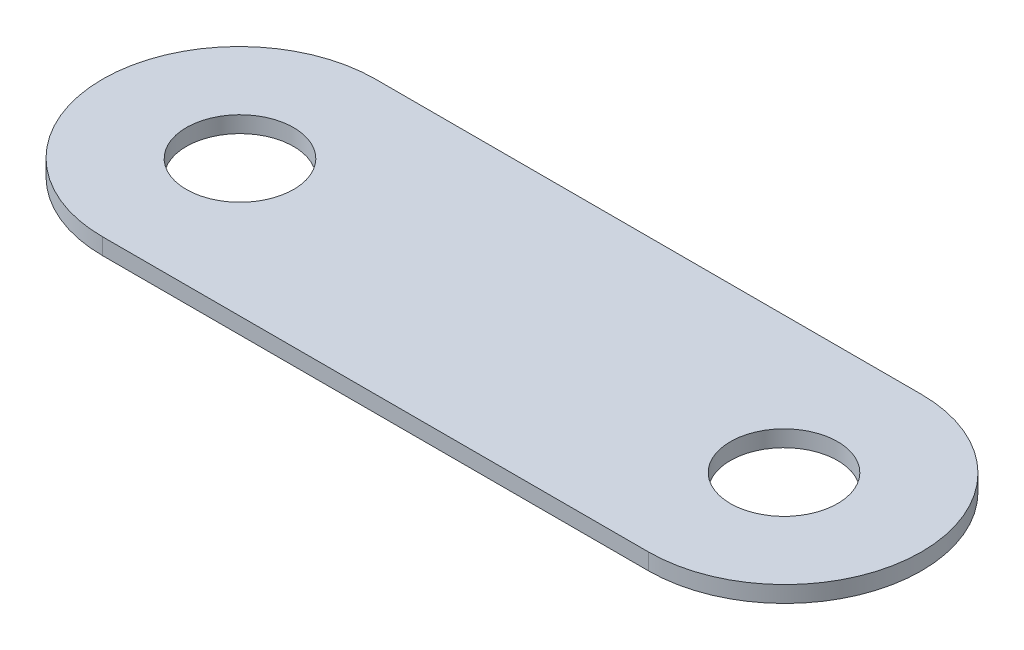
from build123d import *

# Parameters (mm, degrees)
BOSS_EXTRUDE1_DEPTH = 1.2
SKETCH2_R           = 3.93
CUT_EXTRUDE1_DEPTH  = 32.64553681


with BuildPart() as part:
    # Sketch1 → Boss-Extrude1 (new body)
    with BuildSketch(Plane(origin=(0, 0, 0), x_dir=(1, 0, 0), z_dir=(0, 1, 0))):
        with BuildLine():
            Line((-20, 10), (20, 10))
            ThreePointArc((20, 10), (30, 0), (20, -10))
            Line((20, -10), (-20, -10))
            ThreePointArc((-20, -10), (-30, 0), (-20, 10))
        make_face()
    extrude(amount=BOSS_EXTRUDE1_DEPTH)

    # Sketch2 → Cut-Extrude1 (cut, through all)
    with BuildSketch(Plane(origin=(0, 1.2, 0), x_dir=(1, 0, 0), z_dir=(0, 1, 0))):
        with Locations(Location((-19.93, 0, 0), (0, 0, 270))):
            Circle(SKETCH2_R)
        with Locations(Location((19.93, 0, 0), (0, 0, 270))):
            Circle(SKETCH2_R)
    extrude(amount=-CUT_EXTRUDE1_DEPTH, mode=Mode.SUBTRACT)


solid = part.part
